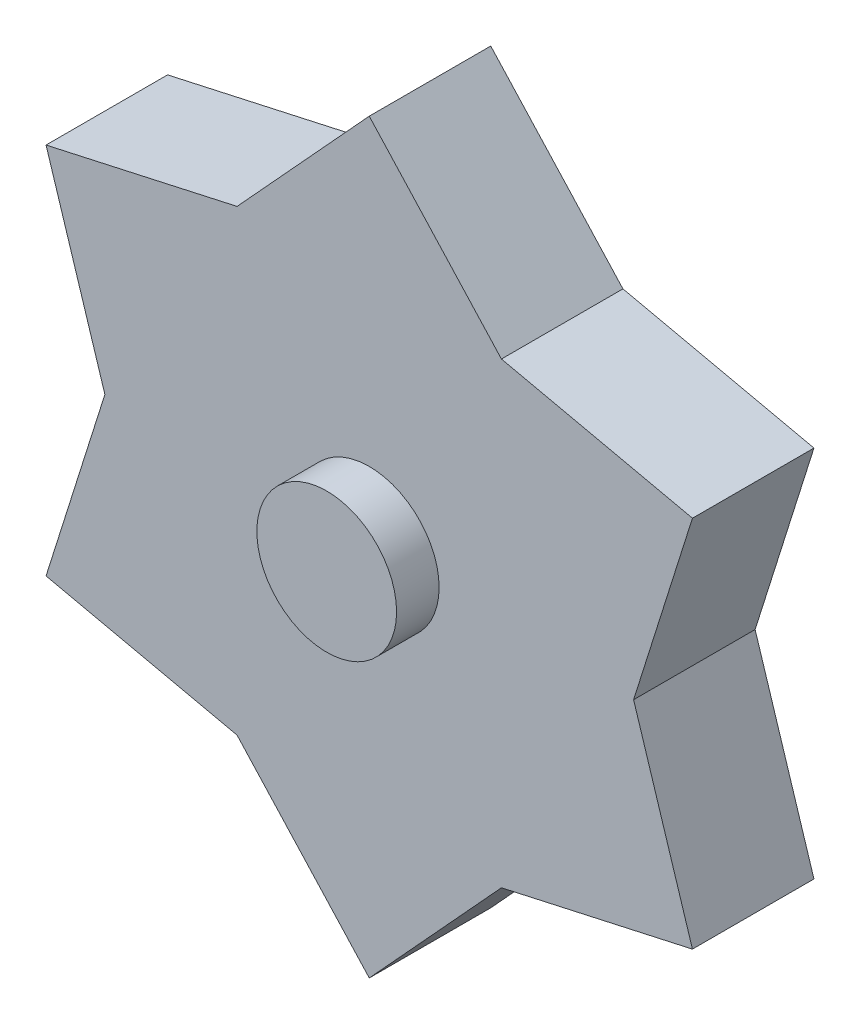
from build123d import *

# Parameters (mm, degrees)
BOSS_EXTRUDE1_DEPTH = 2
SKETCH1_4_R         = 1.15
BOSS_EXTRUDE2_DEPTH = 0.7


with BuildPart() as part:
    # Sketch1 → Boss-Extrude1 (new body)
    with BuildSketch(Plane.XY):
        Polygon((2.175697935, 3.768419365), (0, 6.142777017), (-2.175697935, 3.768419365), (-5.319800946, 3.071388508), (-4.351395869, 0), (-5.319800946, -3.071388508), (-2.175697935, -3.768419365), (0, -6.142777017), (2.175697935, -3.768419365), (5.319800946, -3.071388508), (4.351395869, 0), (5.319800946, 3.071388508), align=None)
    extrude(amount=-BOSS_EXTRUDE1_DEPTH)

    # Sketch1<4> → Boss-Extrude2 (add)
    with BuildSketch(Plane.XY):
        Circle(SKETCH1_4_R)
    extrude(amount=BOSS_EXTRUDE2_DEPTH)


solid = part.part
